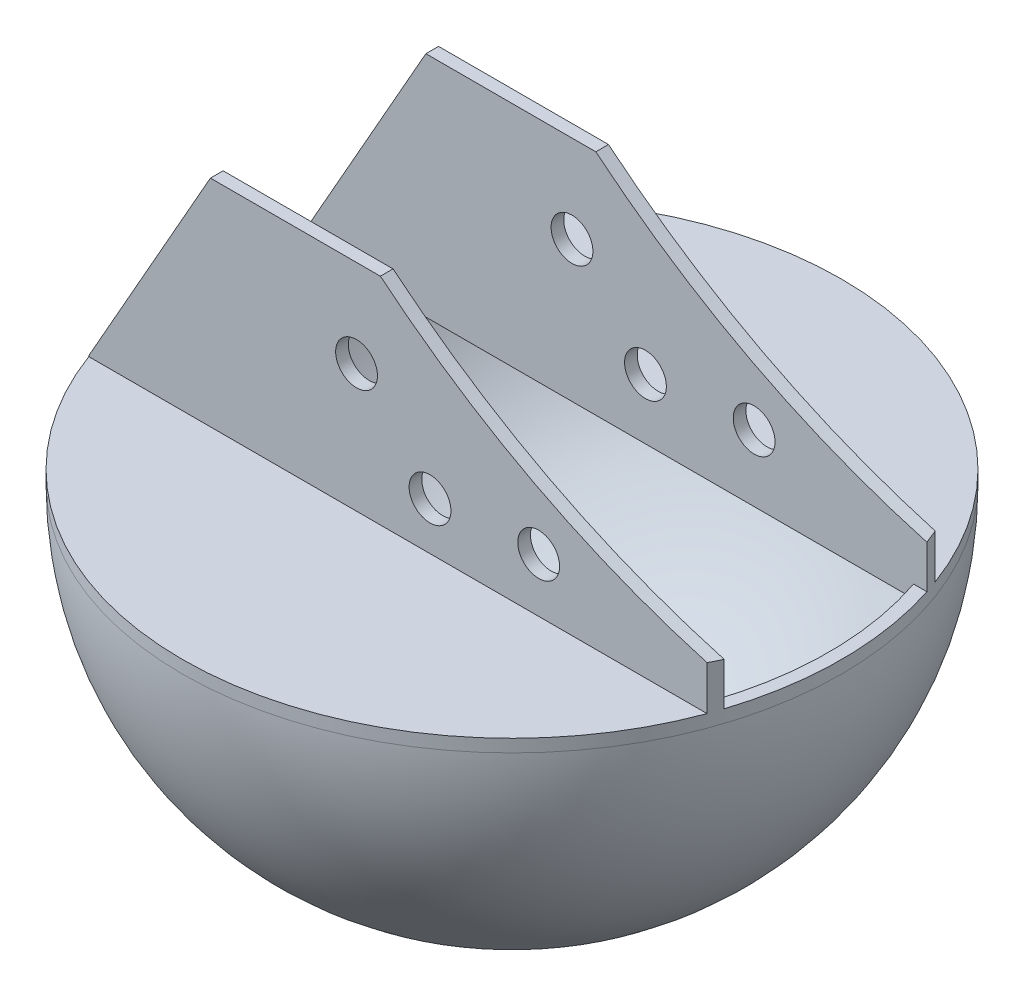
from build123d import *
from build123d.topology import SkipClean

# Parameters (mm, degrees)
SKETCH_2_R          = 26
CUT_EXTRUDE_1_DEPTH = 94
SKETCH_5_R          = 26
SKETCH_5_R_2        = 25
EXTRUDE_1_DEPTH     = 1
EXTRUDE_START       = -1
EXTRUDE_2_DEPTH     = 1
EXTRUDE_3_DEPTH     = 17
CUT_EXTRUDE_2_DEPTH = 36
CUT_EXTRUDE_3_DEPTH = 36
SKETCH_11_R         = 1.65
CUT_EXTRUDE_4_DEPTH = 36
CUT_EXTRUDE_5_DEPTH = 24
CUT_EXTRUDE_6_DEPTH = 21


with BuildPart() as part:
    # 草图1 → 旋转1 (revolve)
    with BuildSketch(Plane.XY):
        with BuildLine():
            Line((0, -26), (0, 26))
            ThreePointArc((0, 26), (-26, 0), (0, -26))
        make_face()
    revolve(axis=Axis((0, 45.173649909, 0), (0, -1, 0)))

    # 草图2 → 切除-拉伸1 (cut)
    with BuildSketch(Plane(origin=(0, 0, 0), x_dir=(1, 0, 0), z_dir=(0, 1, 0))):
        Circle(SKETCH_2_R)
    extrude(amount=CUT_EXTRUDE_1_DEPTH, mode=Mode.SUBTRACT)

    # 草图3 → 切除-旋转3 (revolve, cut)
    with BuildSketch(Plane(origin=(0, 0, 0), x_dir=(1, 0, 0), z_dir=(0, 1, 0))):
        with BuildLine():
            Line((0, -25), (0, 25))
            ThreePointArc((0, 25), (-25, 0), (0, -25))
        make_face()
    revolve(axis=Axis((0, 0, -28.681092659), (0, 0, 1)), mode=Mode.SUBTRACT)

    # 草图5 → 凸台-拉伸1 (add)
    with BuildSketch(Plane(origin=(0, 0, 0), x_dir=(1, 0, 0), z_dir=(0, 1, 0))):
        with Locations(Location((0, 0, 0), (0, 0, 270))):
            Circle(SKETCH_5_R)
        with Locations(Location((0, 0, 0), (0, 0, 270))):
            Circle(SKETCH_5_R_2, mode=Mode.SUBTRACT)
    extrude(amount=EXTRUDE_1_DEPTH)

    # 草图6 → 凸台-拉伸2 (add)
    with BuildSketch(Plane(origin=(0, 1, 0), x_dir=(1, 0, 0), z_dir=(0, 1, 0)).offset(EXTRUDE_START)):
        with BuildLine():
            Line((-23.685438565, 8), (23.685438565, 8))
            ThreePointArc((23.685438565, 8), (0, 25), (-23.685438565, 8))
        make_face()
        with BuildLine():
            Line((-23.685438565, -8), (23.685438565, -8))
            ThreePointArc((23.685438565, -8), (0, -25), (-23.685438565, -8))
        make_face()
    extrude(amount=EXTRUDE_2_DEPTH)

    # 草图7 → 凸台-拉伸3 (add)
    with SkipClean():  # the faces are left unmerged after this step: merging them gives an invalid solid
        with BuildSketch(Plane(origin=(0, 1, 0), x_dir=(1, 0, 0), z_dir=(0, 1, 0))):
            with BuildLine():
                Line((-24.392621835, 9), (24.392621835, 9))
                ThreePointArc((24.392621835, 9), (24.570715678, 8.501760468), (24.738633754, 8))
                Line((24.738633754, 8), (23.685438565, 8))
                Line((23.685438565, 8), (-24.738633754, 8))
                ThreePointArc((-24.738633754, 8), (-24.570715678, 8.501760468), (-24.392621835, 9))
            make_face()
            with BuildLine():
                Line((23.685438565, -8), (-24.738633754, -8))
                ThreePointArc((-24.738633754, -8), (-24.570715678, -8.501760468), (-24.392621835, -9))
                Line((-24.392621835, -9), (24.392621835, -9))
                ThreePointArc((24.392621835, -9), (24.570715678, -8.501760468), (24.738633754, -8))
                Line((24.738633754, -8), (23.685438565, -8))
            make_face()
        extrude(amount=EXTRUDE_3_DEPTH)

    # 草图8 → 切除-拉伸2 (cut)
    with SkipClean():  # the faces are left unmerged after this step: merging them gives an invalid solid
        with BuildSketch(Plane.XY.offset(9)):
            Polygon((-14.795850596, 18), (-24.433102811, 1), (-27.865575535, 20.821993369), align=None)
            with BuildLine():
                Line((0.687726767, 18), (34.870037145, 20.821993369))
                Line((34.870037145, 20.821993369), (23.083657749, 6.66690248))
                ThreePointArc((23.083657749, 6.66690248), (11.027798624, 10.638122439), (0.687726767, 18))
            make_face()
        extrude(amount=-CUT_EXTRUDE_2_DEPTH, mode=Mode.SUBTRACT)

    # 草图9 → 切除-拉伸3 (cut)
    with SkipClean():  # the faces are left unmerged after this step: merging them gives an invalid solid
        with BuildSketch(Plane.XY.offset(9)):
            Polygon((23.083657749, 6.66690248), (25.702074854, 6.219991149), (22.583108189, 9.596015506), align=None)
        extrude(amount=-CUT_EXTRUDE_3_DEPTH, mode=Mode.SUBTRACT)


with BuildPart() as cut_extrude_3_piece_1:
    # of the separate pieces the step leaves, piece 1, a body of its own (cut_extrude_3_pieces)
    add(part.part.solids().sort_by_distance((-26, 0, 0))[0])

    # 草图11 → 切除-拉伸4 (cut)
    with SkipClean():  # the faces are left unmerged after this step: merging them gives an invalid solid
        with BuildSketch(Plane.XY.offset(9)):
            with Locations((11.104767954, 5.240908672)):
                Circle(SKETCH_11_R)
            with Locations((2.530016957, 4.744839309)):
                Circle(SKETCH_11_R)
            with Locations((-3.266619028, 11.082934506)):
                Circle(SKETCH_11_R)
        extrude(amount=-CUT_EXTRUDE_4_DEPTH, mode=Mode.SUBTRACT)


with BuildPart() as cut_extrude_3_piece_2:
    # of the separate pieces the step leaves, piece 2, a body of its own (cut_extrude_3_pieces)
    add(part.part.solids().sort_by_distance((24.738633754, 7.262836736, -8))[0])


with BuildPart() as cut_extrude_3_piece_3:
    # of the separate pieces the step leaves, piece 3, a body of its own (cut_extrude_3_pieces)
    add(part.part.solids().sort_by_distance((24.392621835, 7.63736612, 9))[0])


with BuildPart() as cut_extrude_5_tool:
    # 草图12 → 切除-拉伸5 (new body)
    with SkipClean():  # the faces are left unmerged after this step: merging them gives an invalid solid
        with BuildSketch(Plane.XY.offset(9)):
            Polygon((-24.392621835, 1.071407967), (-24.392621835, 1), (-24.839468696, 1), (-24.839468696, 4.036804799), align=None)
            Polygon((23.434018762, 8.350774332), (25.294876465, 6.489916629), (25.294876465, 10.211632035), align=None)
        extrude(amount=-CUT_EXTRUDE_5_DEPTH)


with BuildPart() as cut_extrude_3_piece_1_1:
    with SkipClean():  # the faces are left unmerged after this step: merging them gives an invalid solid
        add(cut_extrude_3_piece_1.part)

        # 切除-拉伸5: cut by cut_extrude_5_tool
        add(cut_extrude_5_tool.part, mode=Mode.SUBTRACT)

    # 草图13 → 切除-拉伸6 (cut)
    with SkipClean():  # the faces are left unmerged after this step: merging them gives an invalid solid
        with BuildSketch(Plane.XY.offset(9)):
            with BuildLine():
                Line((-1.385151705, 18), (8.416767778, 26.722078747))
                Line((8.416767778, 26.722078747), (30.324490849, 6.517133))
                Line((30.324490849, 6.517133), (24.738633754, 4.383172168))
                ThreePointArc((24.738633754, 4.383172168), (10.961027781, 9.818495417), (-1.385151705, 18))
            make_face()
        extrude(amount=-CUT_EXTRUDE_6_DEPTH, mode=Mode.SUBTRACT)


with BuildPart() as cut_extrude_3_piece_2_1:
    with SkipClean():  # the faces are left unmerged after this step: merging them gives an invalid solid
        add(cut_extrude_3_piece_2.part)

        # 切除-拉伸5: cut by cut_extrude_5_tool
        add(cut_extrude_5_tool.part, mode=Mode.SUBTRACT)


with BuildPart() as cut_extrude_3_piece_3_1:
    with SkipClean():  # the faces are left unmerged after this step: merging them gives an invalid solid
        add(cut_extrude_3_piece_3.part)

        # 切除-拉伸5: cut by cut_extrude_5_tool
        add(cut_extrude_5_tool.part, mode=Mode.SUBTRACT)


solid = cut_extrude_3_piece_1_1.part
